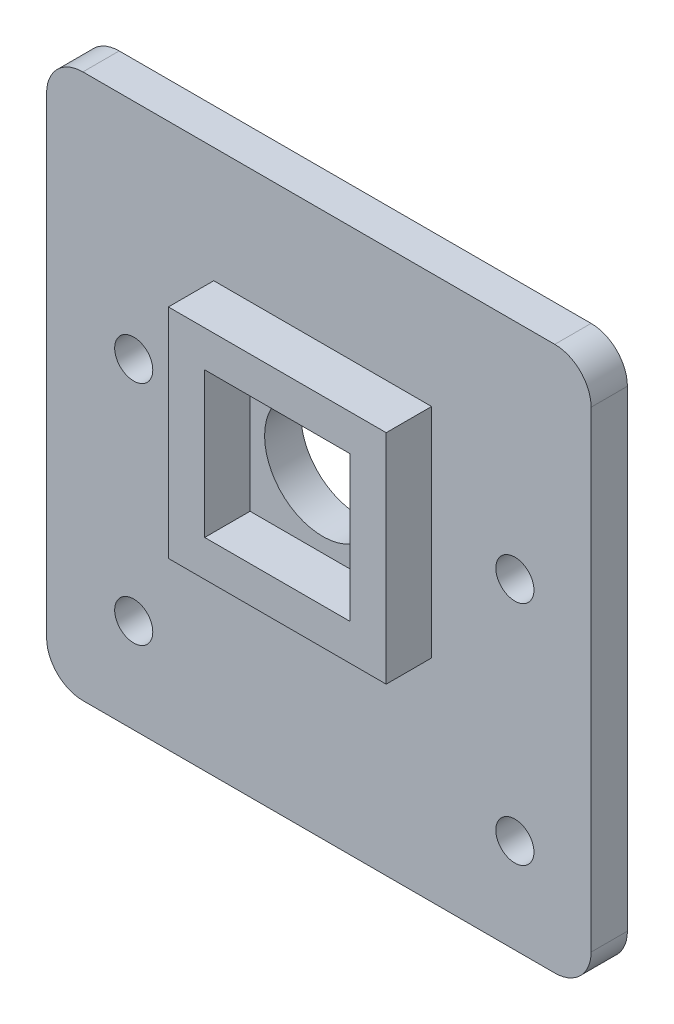
from build123d import *

# Parameters (mm, degrees)
SKETCH1_W           = 30
SKETCH1_H           = 30
BOSS_EXTRUDE1_DEPTH = 2
SKETCH2_R           = 1.05
CUT_EXTRUDE1_DEPTH  = 1.5
SKETCH7_W           = 12
SKETCH7_H           = 12
SKETCH7_W_2         = 8
SKETCH7_H_2         = 8
BOSS_EXTRUDE4_DEPTH = 2.5
SKETCH8_W           = 8
SKETCH8_H           = 8
CUT_EXTRUDE4_DEPTH  = 12.525
SKETCH9_W           = 8
SKETCH9_H           = 8
SKETCH9_R           = 3.2
BOSS_EXTRUDE5_DEPTH = 2
FILLET1_R           = 2
SKETCH12_RX         = 1.08225407
SKETCH12_RY         = 0.934496933
CUT_EXTRUDE6_DEPTH  = 1


with BuildPart() as part:
    # Sketch1 → Boss-Extrude1 (new body)
    with BuildSketch(Plane.XY):
        with Locations((-15, 15)):
            Rectangle(SKETCH1_W, SKETCH1_H)
    extrude(amount=BOSS_EXTRUDE1_DEPTH)

    # Sketch2 → Cut-Extrude1 (cut)
    with BuildSketch(Plane.XY.offset(2)):
        with Locations((-25.2, 5.199)):
            Circle(SKETCH2_R)
        with Locations((-4.2, 5.199)):
            Circle(SKETCH2_R)
        with Locations((-25.2, 17.699)):
            Circle(SKETCH2_R)
        with Locations((-4.2, 17.699)):
            Circle(SKETCH2_R)
    extrude(amount=-CUT_EXTRUDE1_DEPTH, mode=Mode.SUBTRACT)

    # Sketch7 → Boss-Extrude4 (add)
    with BuildSketch(Plane.XY.offset(2)):
        with Locations((-14.79, 17.64)):
            Rectangle(SKETCH7_W, SKETCH7_H)
        with Locations((-14.79, 17.64)):
            Rectangle(SKETCH7_W_2, SKETCH7_H_2, mode=Mode.SUBTRACT)
    extrude(amount=BOSS_EXTRUDE4_DEPTH)

    # Sketch8 → Cut-Extrude4 (cut)
    with BuildSketch(Plane.XY.offset(2)):
        with Locations((-14.79, 17.64)):
            Rectangle(SKETCH8_W, SKETCH8_H)
    extrude(amount=-CUT_EXTRUDE4_DEPTH, mode=Mode.SUBTRACT)

    # Sketch9 → Boss-Extrude5 (add)
    with BuildSketch(Plane(origin=(0, 0, 0), x_dir=(-1, 0, 0), z_dir=(0, 0, -1))):
        with Locations((14.79, 17.64)):
            Rectangle(SKETCH9_W, SKETCH9_H)
        with Locations((14.79, 17.64)):
            Circle(SKETCH9_R, mode=Mode.SUBTRACT)
    extrude(amount=-BOSS_EXTRUDE5_DEPTH)

    # Fillet1
    fillet1_edges = [part.edges().sort_by_distance(p)[0] for p in [
        (0, 0, 1),
        (-30, 0, 1),
        (-30, 30, 1),
        (0, 30, 1),
    ]]
    fillet(fillet1_edges, radius=FILLET1_R)

    # Sketch12 → Cut-Extrude6 (cut)
    with BuildSketch(Plane(origin=(0, 0, 0), x_dir=(-1, 0, 0), z_dir=(0, 0, -1))):
        with BuildLine():
            add(Edge.make_bspline(
                [(4.459403602, 19.771375259), (4.912407636, 19.269824461), (5.586398639, 19.277050424)],
                knots=[0, 0, 0, 1, 1, 1], degree=2))
            add(Edge.make_bspline(
                [(6.713393676, 19.771375259), (6.260389642, 19.269824461), (5.586398639, 19.277050424)],
                knots=[0, 0, 0, 1, 1, 1], degree=2))
            add(Edge.make_bspline(
                [(6.713393676, 19.771375259), (7.196052905, 19.952092522), (7.599188985, 20.273138892)],
                knots=[0, 0, 0, 1, 1, 1], degree=2))
            add(Edge.make_bspline(
                [(7.599188985, 20.273138892), (8.397558594, 20.602400878), (8.52603066, 21.461318387)],
                knots=[0, 0, 0, 1, 1, 1], degree=2))
            add(Edge.make_bspline(
                [(8.52603066, 21.461318387), (8.675799132, 21.754733655), (8.731344628, 22.079239005)],
                knots=[0, 0, 0, 1, 1, 1], degree=2))
            add(Edge.make_bspline(
                [(8.731344628, 22.079239005), (8.95937766, 22.334907166), (9.271923181, 23.113838557), (8.891670497, 23.844453066), (8.500758535, 24.129779947)],
                knots=[0, 0, 0, 0, 0.443043689, 1, 1, 1, 1], degree=3))
            add(Edge.make_bspline(
                [(8.500758535, 24.129779947), (8.478718718, 24.18503617), (8.457636185, 24.214759628), (8.428622759, 24.253712768)],
                knots=[0, 0, 0, 0, 1, 1, 1, 1], degree=3))
            add(Edge.make_bspline(
                [(8.428622759, 24.253712768), (8.428621924, 25.22422519), (7.626737517, 25.638554342)],
                knots=[0, 0, 0, 1, 1, 1], degree=2))
            add(Edge.make_bspline(
                [(7.626737517, 25.638554342), (7.860931009, 25.653004869), (7.93621595, 25.867644567)],
                knots=[0, 0, 0, 1, 1, 1], degree=2))
            add(Edge.make_bspline(
                [(7.93621595, 25.867644567), (8.074561594, 25.923571952), (8.214105248, 25.976133461), (8.2192724, 26.156628761)],
                knots=[0, 0, 0, 0, 1, 1, 1, 1], degree=3))
            add(Edge.make_bspline(
                [(8.2192724, 26.156628761), (8.424348668, 26.273546154), (8.445789796, 26.289542187), (8.460640776, 26.494419709)],
                knots=[0, 0, 0, 0, 1, 1, 1, 1], degree=3))
            add(Edge.make_bspline(
                [(8.460640776, 26.494419709), (8.666468831, 26.614269665), (8.600808664, 26.810969099)],
                knots=[0, 0, 0, 1, 1, 1], degree=2))
            add(Edge.make_bspline(
                [(8.600808664, 26.810969099), (8.686005059, 26.931306999), (8.78711559, 26.988922663), (8.695448657, 27.149855286)],
                knots=[0, 0, 0, 0, 1, 1, 1, 1], degree=3))
            add(Edge.make_bspline(
                [(8.695448657, 27.149855286), (8.874684574, 27.334661986), (8.70365618, 27.508525165)],
                knots=[0, 0, 0, 1, 1, 1], degree=2))
            add(Edge.make_bspline(
                [(8.70365618, 27.508525165), (8.817322065, 27.616661491), (8.74901534, 27.856821541), (8.591961084, 27.873600404)],
                knots=[0, 0, 0, 0, 1, 1, 1, 1], degree=3))
            add(Edge.make_bspline(
                [(8.591961084, 27.873600404), (8.510777555, 27.890602349), (8.428622759, 27.879782716)],
                knots=[0, 0, 0, 1, 1, 1], degree=2))
            add(Edge.make_bspline(
                [(8.428622759, 27.879782716), (8.346506515, 28.02047312), (8.179378561, 28.008018455)],
                knots=[0, 0, 0, 1, 1, 1], degree=2))
            add(Edge.make_bspline(
                [(8.179378561, 28.008018455), (8.098001415, 28.027466053), (8.015680886, 28.012512611)],
                knots=[0, 0, 0, 1, 1, 1], degree=2))
            add(Edge.make_bspline(
                [(8.015680886, 28.012512611), (7.961203369, 28.115859289), (7.82679737, 28.102795345), (7.732961122, 28.089490893)],
                knots=[0, 0, 0, 0, 1, 1, 1, 1], degree=3))
            add(Edge.make_bspline(
                [(7.732961122, 28.089490893), (7.626988483, 28.1763667), (7.582209475, 28.209626094), (7.355100325, 28.135078485)],
                knots=[0, 0, 0, 0, 1, 1, 1, 1], degree=3))
            add(Edge.make_bspline(
                [(7.355100325, 28.135078485), (7.161176886, 28.259963832), (6.966767125, 28.119172751)],
                knots=[0, 0, 0, 1, 1, 1], degree=2))
            add(Edge.make_bspline(
                [(6.966767125, 28.119172751), (6.784023173, 28.191921236), (6.625379677, 28.047927)],
                knots=[0, 0, 0, 1, 1, 1], degree=2))
            add(Edge.make_bspline(
                [(6.625379677, 28.047927), (6.470921635, 28.13787836), (6.335334768, 28.001630777), (6.253891197, 27.901475323)],
                knots=[0, 0, 0, 0, 1, 1, 1, 1], degree=3))
            add(Edge.make_bspline(
                [(6.253891197, 27.901475323), (6.184624009, 27.911295697), (6.07299926, 27.881514493), (5.938040799, 27.758029169), (5.716439457, 27.541148249), (5.586398639, 27.097153118)],
                knots=[0, 0, 0, 0, 0.092600111, 0.192600111, 1, 1, 1, 1], degree=3))
            add(Edge.make_bspline(
                [(4.918906081, 27.901475323), (4.988173268, 27.911295697), (5.099798017, 27.881514493), (5.234756478, 27.758029169), (5.45635782, 27.541148249), (5.586398639, 27.097153118)],
                knots=[0, 0, 0, 0, 0.092600111, 0.192600111, 1, 1, 1, 1], degree=3))
            add(Edge.make_bspline(
                [(4.5474176, 28.047927), (4.701875642, 28.13787836), (4.837462509, 28.001630777), (4.918906081, 27.901475323)],
                knots=[0, 0, 0, 0, 1, 1, 1, 1], degree=3))
            add(Edge.make_bspline(
                [(4.206030152, 28.119172751), (4.388774104, 28.191921236), (4.5474176, 28.047927)],
                knots=[0, 0, 0, 1, 1, 1], degree=2))
            add(Edge.make_bspline(
                [(3.817696952, 28.135078485), (4.011620391, 28.259963832), (4.206030152, 28.119172751)],
                knots=[0, 0, 0, 1, 1, 1], degree=2))
            add(Edge.make_bspline(
                [(3.439836155, 28.089490893), (3.545808795, 28.1763667), (3.590587802, 28.209626094), (3.817696952, 28.135078485)],
                knots=[0, 0, 0, 0, 1, 1, 1, 1], degree=3))
            add(Edge.make_bspline(
                [(3.157116391, 28.012512611), (3.211593908, 28.115859289), (3.345999907, 28.102795345), (3.439836155, 28.089490893)],
                knots=[0, 0, 0, 0, 1, 1, 1, 1], degree=3))
            add(Edge.make_bspline(
                [(2.993418716, 28.008018455), (3.074795862, 28.027466053), (3.157116391, 28.012512611)],
                knots=[0, 0, 0, 1, 1, 1], degree=2))
            add(Edge.make_bspline(
                [(2.744174518, 27.879782716), (2.826290763, 28.02047312), (2.993418716, 28.008018455)],
                knots=[0, 0, 0, 1, 1, 1], degree=2))
            add(Edge.make_bspline(
                [(2.580836193, 27.873600404), (2.662019722, 27.890602349), (2.744174518, 27.879782716)],
                knots=[0, 0, 0, 1, 1, 1], degree=2))
            add(Edge.make_bspline(
                [(2.469141098, 27.508525165), (2.355475212, 27.616661491), (2.423781937, 27.856821541), (2.580836193, 27.873600404)],
                knots=[0, 0, 0, 0, 1, 1, 1, 1], degree=3))
            add(Edge.make_bspline(
                [(2.47734862, 27.149855286), (2.298112703, 27.334661986), (2.469141098, 27.508525165)],
                knots=[0, 0, 0, 1, 1, 1], degree=2))
            add(Edge.make_bspline(
                [(2.571988613, 26.810969099), (2.486792218, 26.931306999), (2.385681687, 26.988922663), (2.47734862, 27.149855286)],
                knots=[0, 0, 0, 0, 1, 1, 1, 1], degree=3))
            add(Edge.make_bspline(
                [(2.712156501, 26.494419709), (2.506328446, 26.614269665), (2.571988613, 26.810969099)],
                knots=[0, 0, 0, 1, 1, 1], degree=2))
            add(Edge.make_bspline(
                [(2.953524877, 26.156628761), (2.748448609, 26.273546154), (2.727007481, 26.289542187), (2.712156501, 26.494419709)],
                knots=[0, 0, 0, 0, 1, 1, 1, 1], degree=3))
            add(Edge.make_bspline(
                [(3.236581327, 25.867644567), (3.098235683, 25.923571952), (2.95869203, 25.976133461), (2.953524877, 26.156628761)],
                knots=[0, 0, 0, 0, 1, 1, 1, 1], degree=3))
            add(Edge.make_bspline(
                [(3.54605976, 25.638554342), (3.311866268, 25.653004869), (3.236581327, 25.867644567)],
                knots=[0, 0, 0, 1, 1, 1], degree=2))
            add(Edge.make_bspline(
                [(2.744174518, 24.253712768), (2.744175353, 25.22422519), (3.54605976, 25.638554342)],
                knots=[0, 0, 0, 1, 1, 1], degree=2))
            add(Edge.make_bspline(
                [(2.672038742, 24.129779947), (2.694078559, 24.18503617), (2.715161092, 24.214759628), (2.744174518, 24.253712768)],
                knots=[0, 0, 0, 0, 1, 1, 1, 1], degree=3))
            add(Edge.make_bspline(
                [(2.44145265, 22.079239005), (2.213419618, 22.334907166), (1.900874096, 23.113838557), (2.28112678, 23.844453066), (2.672038742, 24.129779947)],
                knots=[0, 0, 0, 0, 0.443043689, 1, 1, 1, 1], degree=3))
            add(Edge.make_bspline(
                [(2.646766617, 21.461318387), (2.496998145, 21.754733655), (2.44145265, 22.079239005)],
                knots=[0, 0, 0, 1, 1, 1], degree=2))
            add(Edge.make_bspline(
                [(3.573608292, 20.273138892), (2.775238684, 20.602400878), (2.646766617, 21.461318387)],
                knots=[0, 0, 0, 1, 1, 1], degree=2))
            add(Edge.make_bspline(
                [(4.459403602, 19.771375259), (3.976744372, 19.952092522), (3.573608292, 20.273138892)],
                knots=[0, 0, 0, 1, 1, 1], degree=2))
        make_face()
        with Locations(Location((4.405907044, 23.508437964), (0, 0, 58.172946219))):
            Ellipse(SKETCH12_RX, SKETCH12_RY, mode=Mode.SUBTRACT)
        with Locations(Location((6.766890234, 23.508437964), (0, 0, 121.827053781))):
            Ellipse(SKETCH12_RX, SKETCH12_RY, mode=Mode.SUBTRACT)
        with BuildLine():
            Line((6.08649801, 26.438677052), (6.111751446, 26.436685192))
            add(Edge.make_bspline(
                [(6.111751446, 26.436685192), (6.885511107, 27.050721512), (7.824772953, 27.351752714)],
                knots=[0, 0, 0, 1, 1, 1], degree=2))
            add(Edge.make_bspline(
                [(7.824772953, 27.351752714), (7.454373779, 27.158058721), (6.904278751, 26.866591311), (6.42745025, 26.469902009), (6.235121044, 26.265811815)],
                knots=[0, 0, 0, 0, 0.517858007, 1, 1, 1, 1], degree=3))
            add(Edge.make_bspline(
                [(6.235121044, 26.265811815), (6.270374396, 26.140801177), (6.454124689, 25.775029957), (7.066579783, 25.690578213), (7.364524085, 25.721805094)],
                knots=[0, 0, 0, 0, 0.232284821, 1, 1, 1, 1], degree=3))
            add(Edge.make_bspline(
                [(7.364524085, 25.721805094), (7.289095896, 25.749377061), (7.2441534, 25.815470697)],
                knots=[0, 0, 0, 1, 1, 1], degree=2))
            add(Edge.make_bspline(
                [(7.2441534, 25.815470697), (7.479971995, 25.8262006), (7.70171926, 25.905261676)],
                knots=[0, 0, 0, 1, 1, 1], degree=2))
            add(Edge.make_bspline(
                [(7.70171926, 25.905261676), (7.620100101, 25.917656948), (7.574814139, 25.986053914)],
                knots=[0, 0, 0, 1, 1, 1], degree=2))
            add(Edge.make_bspline(
                [(7.574814139, 25.986053914), (7.799399897, 26.021224291), (7.986985455, 26.147741737)],
                knots=[0, 0, 0, 1, 1, 1], degree=2))
            add(Edge.make_bspline(
                [(7.986985455, 26.147741737), (7.895002718, 26.143175182), (7.824772953, 26.199753276)],
                knots=[0, 0, 0, 1, 1, 1], degree=2))
            add(Edge.make_bspline(
                [(7.824772953, 26.199753276), (8.049085207, 26.277525955), (8.224699767, 26.435655209)],
                knots=[0, 0, 0, 1, 1, 1], degree=2))
            add(Edge.make_bspline(
                [(8.224699767, 26.435655209), (8.136050851, 26.420029814), (8.060263374, 26.464368629)],
                knots=[0, 0, 0, 1, 1, 1], degree=2))
            add(Edge.make_bspline(
                [(8.060263374, 26.464368629), (8.23349761, 26.574811482), (8.376674573, 26.721758001)],
                knots=[0, 0, 0, 1, 1, 1], degree=2))
            add(Edge.make_bspline(
                [(8.376674573, 26.721758001), (8.286052566, 26.709117633), (8.206143834, 26.748898346)],
                knots=[0, 0, 0, 1, 1, 1], degree=2))
            add(Edge.make_bspline(
                [(8.206143834, 26.748898346), (8.377014116, 26.864310727), (8.491708975, 27.034206058)],
                knots=[0, 0, 0, 1, 1, 1], degree=2))
            add(Edge.make_bspline(
                [(8.491708975, 27.034206058), (8.385784369, 26.998241293), (8.287994307, 27.045482096)],
                knots=[0, 0, 0, 1, 1, 1], degree=2))
            add(Edge.make_bspline(
                [(8.287994307, 27.045482096), (8.442635079, 27.165959108), (8.546308384, 27.330655805)],
                knots=[0, 0, 0, 1, 1, 1], degree=2))
            add(Edge.make_bspline(
                [(8.546308384, 27.330655805), (8.456800152, 27.313699686), (8.366950746, 27.324132413)],
                knots=[0, 0, 0, 1, 1, 1], degree=2))
            add(Edge.make_bspline(
                [(8.366950746, 27.324132413), (8.408920944, 27.510064067), (8.540625658, 27.648445817)],
                knots=[0, 0, 0, 1, 1, 1], degree=2))
            add(Edge.make_bspline(
                [(8.540625658, 27.648445817), (8.331115101, 27.638655118), (8.122219886, 27.657787318)],
                knots=[0, 0, 0, 1, 1, 1], degree=2))
            add(Edge.make_bspline(
                [(8.122219886, 27.657787318), (8.166226584, 27.72191231), (8.228695231, 27.768286277)],
                knots=[0, 0, 0, 1, 1, 1], degree=2))
            add(Edge.make_bspline(
                [(8.228695231, 27.768286277), (8.002049808, 27.819175755), (7.779484934, 27.725127608)],
                knots=[0, 0, 0, 1, 1, 1], degree=2))
            add(Edge.make_bspline(
                [(7.779484934, 27.725127608), (7.698207386, 27.760325889), (7.815128112, 27.858727649), (7.847720075, 27.86351944)],
                knots=[0, 0, 0, 0, 1, 1, 1, 1], degree=3))
            add(Edge.make_bspline(
                [(7.847720075, 27.86351944), (7.646450968, 27.87197809), (7.463642507, 27.777476203)],
                knots=[0, 0, 0, 1, 1, 1], degree=2))
            add(Edge.make_bspline(
                [(7.463642507, 27.777476203), (7.420242067, 27.82092425), (7.479417005, 27.869007732), (7.557483786, 27.940730551)],
                knots=[0, 0, 0, 0, 1, 1, 1, 1], degree=3))
            add(Edge.make_bspline(
                [(7.557483786, 27.940730551), (7.337700995, 27.918283814), (7.159609967, 27.791409039)],
                knots=[0, 0, 0, 1, 1, 1], degree=2))
            add(Edge.make_bspline(
                [(7.159609967, 27.791409039), (7.089781524, 27.827253318), (7.162497176, 27.926863021), (7.196015201, 27.952675018)],
                knots=[0, 0, 0, 0, 1, 1, 1, 1], degree=3))
            add(Edge.make_bspline(
                [(7.196015201, 27.952675018), (7.002250721, 27.895616459), (6.859945024, 27.754122582)],
                knots=[0, 0, 0, 1, 1, 1], degree=2))
            add(Edge.make_bspline(
                [(6.859945024, 27.754122582), (6.78458604, 27.82488446), (6.850124774, 27.905105945)],
                knots=[0, 0, 0, 1, 1, 1], degree=2))
            add(Edge.make_bspline(
                [(6.850124774, 27.905105945), (6.69376598, 27.827707321), (6.592525069, 27.687902192)],
                knots=[0, 0, 0, 1, 1, 1], degree=2))
            add(Edge.make_bspline(
                [(6.592525069, 27.687902192), (6.535036206, 27.70853545), (6.514292349, 27.733980608), (6.537031069, 27.844373499)],
                knots=[0, 0, 0, 0, 1, 1, 1, 1], degree=3))
            add(Edge.make_bspline(
                [(6.537031069, 27.844373499), (6.364380434, 27.718672212), (6.249148418, 27.538848703)],
                knots=[0, 0, 0, 1, 1, 1], degree=2))
            add(Edge.make_bspline(
                [(6.249148418, 27.538848703), (6.204292053, 27.595387917), (6.201607217, 27.668184547)],
                knots=[0, 0, 0, 1, 1, 1], degree=2))
            add(Edge.make_bspline(
                [(6.201607217, 27.668184547), (6.066821617, 27.567774233), (5.894337442, 27.298863011), (5.742246132, 26.821171911), (5.85300032, 26.54971625), (6.08649801, 26.438677052)],
                knots=[0, 0, 0, 0, 0.370606673, 0.596988374, 1, 1, 1, 1], degree=3))
        make_face(mode=Mode.SUBTRACT)
        with BuildLine():
            ThreePointArc((4.612820244, 22.00098137), (4.567981089, 21.763409199), (4.580272209, 21.521955239))
            add(Edge.make_bspline(
                [(4.580272209, 21.521955239), (4.776572867, 20.963402314), (5.225788367, 20.789034476), (5.586398639, 20.791439779)],
                knots=[0, 0, 0, 0, 0.451501299, 0.451501299, 0.451501299, 0.451501299], degree=3))
            add(Edge.make_bspline(
                [(6.592525069, 21.521955239), (6.39622441, 20.963402314), (5.94700891, 20.789034476), (5.586398639, 20.791439779)],
                knots=[0, 0, 0, 0, 0.451501299, 0.451501299, 0.451501299, 0.451501299], degree=3))
            ThreePointArc((6.592525069, 21.521955239), (6.604816189, 21.763409199), (6.559977033, 22.00098137))
            add(Edge.make_bspline(
                [(6.559977033, 22.00098137), (6.357454249, 22.467885386), (5.986560514, 22.67199591), (5.586398639, 22.666403467)],
                knots=[0, 0, 0, 0, 0.494480302, 0.494480302, 0.494480302, 0.494480302], degree=3))
            add(Edge.make_bspline(
                [(4.612820244, 22.00098137), (4.815343029, 22.467885386), (5.186236764, 22.67199591), (5.586398639, 22.666403467)],
                knots=[0, 0, 0, 0, 0.494480302, 0.494480302, 0.494480302, 0.494480302], degree=3))
        make_face(mode=Mode.SUBTRACT)
        with BuildLine():
            add(Edge.make_bspline(
                [(3.764742911, 20.500365273), (5.404831735, 19.783274916), (4.131472178, 21.600691919), (2.858112621, 23.418108923), (2.907931563, 21.723259077)],
                knots=[2.366966, 2.366966, 2.366966, 4.663333265, 4.663333265, 6.959700531, 6.959700531, 6.959700531], degree=2, weights=[1, 0.410144681, 1, 0.410144681, 1]))
            add(Edge.make_bspline(
                [(2.907931563, 21.723259077), (2.920038841, 20.812145325), (3.764742911, 20.500365273)],
                knots=[0, 0, 0, 1, 1, 1], degree=2))
        make_face(mode=Mode.SUBTRACT)
        with BuildLine():
            add(Edge.make_bspline(
                [(8.264865714, 21.723259077), (8.314684657, 23.418108923), (7.0413251, 21.600691919), (5.767965543, 19.783274916), (7.408054366, 20.500365273)],
                knots=[5.606670083, 5.606670083, 5.606670083, 7.903037349, 7.903037349, 10.199404615, 10.199404615, 10.199404615], degree=2, weights=[1, 0.410144681, 1, 0.410144681, 1]))
            add(Edge.make_bspline(
                [(8.264865714, 21.723259077), (8.252758437, 20.812145325), (7.408054366, 20.500365273)],
                knots=[0, 0, 0, 1, 1, 1], degree=2))
        make_face(mode=Mode.SUBTRACT)
        with BuildLine():
            add(Edge.make_bspline(
                [(4.466123523, 25.441001911), (4.086927345, 25.540969838), (3.700713194, 25.458186294), (3.199637125, 25.064802498), (3.025415423, 24.718685589), (3.027167829, 24.259268783)],
                knots=[0, 0, 0, 0, 0.450332453, 0.550332453, 1, 1, 1, 1], degree=3))
            add(Edge.make_bspline(
                [(3.027167829, 24.259268783), (3.106748087, 24.237012666), (3.178442721, 24.273641573)],
                knots=[0, 0, 0, 1, 1, 1], degree=2))
            add(Edge.make_bspline(
                [(4.419218373, 25.299768821), (3.902694398, 24.66228955), (3.178442721, 24.273641573)],
                knots=[0, 0, 0, 1, 1, 1], degree=2))
            add(Edge.make_bspline(
                [(4.466123523, 25.441001911), (4.480312154, 25.356940397), (4.419218373, 25.299768821)],
                knots=[0, 0, 0, 1, 1, 1], degree=2))
        make_face(mode=Mode.SUBTRACT)
        with BuildLine():
            add(Edge.make_bspline(
                [(2.920149283, 23.95932049), (2.566641088, 23.757628895), (2.212726891, 23.085074878), (2.472798313, 22.44950358), (2.703652148, 22.225813707)],
                knots=[0, 0, 0, 0, 0.560262141, 1, 1, 1, 1], degree=3))
            add(Edge.make_bspline(
                [(2.703652148, 22.225813707), (2.831680868, 22.205991931), (2.918931189, 22.368104891), (2.953524877, 22.458251966)],
                knots=[0, 0, 0, 0, 1, 1, 1, 1], degree=3))
            add(Edge.make_bspline(
                [(3.129952842, 23.606412415), (3.159527259, 23.014069316), (2.953524877, 22.458251966)],
                knots=[0, 0, 0, 1, 1, 1], degree=2))
            add(Edge.make_bspline(
                [(2.920149283, 23.95932049), (2.9672441, 23.980027055), (3.095998434, 23.880874992), (3.118827643, 23.716003892), (3.129952842, 23.606412415)],
                knots=[0, 0, 0, 0, 0.260652377, 1, 1, 1, 1], degree=3))
        make_face(mode=Mode.SUBTRACT)
        with BuildLine():
            add(Edge.make_bspline(
                [(4.592762054, 20.132257683), (4.628084178, 20.266986671), (4.821483922, 20.361236592), (5.156980432, 20.477817385), (5.290149775, 20.471163199), (5.586398639, 20.490509382)],
                knots=[0, 0, 0, 0, 0.336340026, 0.436340026, 1, 1, 1, 1], degree=3))
            add(Edge.make_bspline(
                [(6.580035224, 20.132257683), (6.5447131, 20.266986671), (6.351313355, 20.361236592), (6.015816846, 20.477817385), (5.882647503, 20.471163199), (5.586398639, 20.490509382)],
                knots=[0, 0, 0, 0, 0.336340026, 0.436340026, 1, 1, 1, 1], degree=3))
            add(Edge.make_bspline(
                [(6.580035224, 20.132257683), (6.587849476, 20.086275127), (6.566483757, 20.045488858)],
                knots=[0, 0, 0, 1, 1, 1], degree=2))
            add(Edge.make_bspline(
                [(6.566483757, 20.045488858), (6.468634283, 19.895351444), (6.288690006, 19.744880025), (5.984390237, 19.604380093), (5.797845315, 19.549618163), (5.586398639, 19.555887753)],
                knots=[0, 0, 0, 0, 0.397504027, 0.497504027, 1, 1, 1, 1], degree=3))
            add(Edge.make_bspline(
                [(4.606313521, 20.045488858), (4.704162994, 19.895351444), (4.884107271, 19.744880025), (5.188407041, 19.604380093), (5.374951962, 19.549618163), (5.586398639, 19.555887753)],
                knots=[0, 0, 0, 0, 0.397504027, 0.497504027, 1, 1, 1, 1], degree=3))
            add(Edge.make_bspline(
                [(4.592762054, 20.132257683), (4.584947801, 20.086275127), (4.606313521, 20.045488858)],
                knots=[0, 0, 0, 1, 1, 1], degree=2))
        make_face(mode=Mode.SUBTRACT)
        with BuildLine():
            add(Edge.make_bspline(
                [(5.586398639, 25.692086573), (5.276104282, 25.712556849), (4.803293798, 25.516618594), (4.659899355, 25.213870909)],
                knots=[0, 0, 0, 0, 1, 1, 1, 1], degree=3))
            add(Edge.make_bspline(
                [(4.659899355, 25.213870909), (4.633193994, 25.112676741), (4.67455899, 25.016009288)],
                knots=[0, 0, 0, 1, 1, 1], degree=2))
            add(Edge.make_bspline(
                [(4.67455899, 25.016009288), (4.720297226, 24.888156462), (5.027505864, 24.675460093), (5.368291476, 24.614462454), (5.586398639, 24.609837723)],
                knots=[0, 0, 0, 0, 0.380769232, 1, 1, 1, 1], degree=3))
            add(Edge.make_bspline(
                [(6.498238287, 25.016009288), (6.452500051, 24.888156462), (6.145291414, 24.675460093), (5.804505801, 24.614462454), (5.586398639, 24.609837723)],
                knots=[0, 0, 0, 0, 0.380769232, 1, 1, 1, 1], degree=3))
            add(Edge.make_bspline(
                [(6.512897923, 25.213870909), (6.539603283, 25.112676741), (6.498238287, 25.016009288)],
                knots=[0, 0, 0, 1, 1, 1], degree=2))
            add(Edge.make_bspline(
                [(5.586398639, 25.692086573), (5.896692996, 25.712556849), (6.369503479, 25.516618594), (6.512897923, 25.213870909)],
                knots=[0, 0, 0, 0, 1, 1, 1, 1], degree=3))
        make_face(mode=Mode.SUBTRACT)
        with BuildLine():
            add(Edge.make_bspline(
                [(8.042844435, 23.606412415), (8.013270018, 23.014069316), (8.2192724, 22.458251966)],
                knots=[0, 0, 0, 1, 1, 1], degree=2))
            add(Edge.make_bspline(
                [(8.469145129, 22.225813707), (8.34111641, 22.205991931), (8.253866088, 22.368104891), (8.2192724, 22.458251966)],
                knots=[0, 0, 0, 0, 1, 1, 1, 1], degree=3))
            add(Edge.make_bspline(
                [(8.252647994, 23.95932049), (8.606156189, 23.757628895), (8.960070386, 23.085074878), (8.699998964, 22.44950358), (8.469145129, 22.225813707)],
                knots=[0, 0, 0, 0, 0.560262141, 1, 1, 1, 1], degree=3))
            add(Edge.make_bspline(
                [(8.252647994, 23.95932049), (8.205553178, 23.980027055), (8.076798843, 23.880874992), (8.053969635, 23.716003892), (8.042844435, 23.606412415)],
                knots=[0, 0, 0, 0, 0.260652377, 1, 1, 1, 1], degree=3))
        make_face(mode=Mode.SUBTRACT)
        with BuildLine():
            add(Edge.make_bspline(
                [(6.753578904, 25.299768821), (7.270102879, 24.66228955), (7.994354556, 24.273641573)],
                knots=[0, 0, 0, 1, 1, 1], degree=2))
            add(Edge.make_bspline(
                [(8.145629448, 24.259268783), (8.066049191, 24.237012666), (7.994354556, 24.273641573)],
                knots=[0, 0, 0, 1, 1, 1], degree=2))
            add(Edge.make_bspline(
                [(6.706673755, 25.441001911), (7.085869932, 25.540969838), (7.472084083, 25.458186294), (7.973160152, 25.064802498), (8.147381855, 24.718685589), (8.145629448, 24.259268783)],
                knots=[0, 0, 0, 0, 0.450332453, 0.550332453, 1, 1, 1, 1], degree=3))
            add(Edge.make_bspline(
                [(6.706673755, 25.441001911), (6.692485123, 25.356940397), (6.753578904, 25.299768821)],
                knots=[0, 0, 0, 1, 1, 1], degree=2))
        make_face(mode=Mode.SUBTRACT)
        with BuildLine():
            add(Edge.make_bspline(
                [(3.808273192, 25.721805094), (3.883701381, 25.749377061), (3.928643877, 25.815470697)],
                knots=[0, 0, 0, 1, 1, 1], degree=2))
            add(Edge.make_bspline(
                [(3.928643877, 25.815470697), (3.692825282, 25.8262006), (3.471078017, 25.905261676)],
                knots=[0, 0, 0, 1, 1, 1], degree=2))
            add(Edge.make_bspline(
                [(3.471078017, 25.905261676), (3.552697176, 25.917656948), (3.597983138, 25.986053914)],
                knots=[0, 0, 0, 1, 1, 1], degree=2))
            add(Edge.make_bspline(
                [(3.597983138, 25.986053914), (3.373397381, 26.021224291), (3.185811822, 26.147741737)],
                knots=[0, 0, 0, 1, 1, 1], degree=2))
            add(Edge.make_bspline(
                [(3.185811822, 26.147741737), (3.27779456, 26.143175182), (3.348024324, 26.199753276)],
                knots=[0, 0, 0, 1, 1, 1], degree=2))
            add(Edge.make_bspline(
                [(3.348024324, 26.199753276), (3.12371207, 26.277525955), (2.94809751, 26.435655209)],
                knots=[0, 0, 0, 1, 1, 1], degree=2))
            add(Edge.make_bspline(
                [(2.94809751, 26.435655209), (3.036746426, 26.420029814), (3.112533904, 26.464368629)],
                knots=[0, 0, 0, 1, 1, 1], degree=2))
            add(Edge.make_bspline(
                [(3.112533904, 26.464368629), (2.939299667, 26.574811482), (2.796122705, 26.721758001)],
                knots=[0, 0, 0, 1, 1, 1], degree=2))
            add(Edge.make_bspline(
                [(2.796122705, 26.721758001), (2.886744711, 26.709117633), (2.966653443, 26.748898346)],
                knots=[0, 0, 0, 1, 1, 1], degree=2))
            add(Edge.make_bspline(
                [(2.966653443, 26.748898346), (2.795783161, 26.864310727), (2.681088302, 27.034206058)],
                knots=[0, 0, 0, 1, 1, 1], degree=2))
            add(Edge.make_bspline(
                [(2.681088302, 27.034206058), (2.787012908, 26.998241293), (2.884802971, 27.045482096)],
                knots=[0, 0, 0, 1, 1, 1], degree=2))
            add(Edge.make_bspline(
                [(2.884802971, 27.045482096), (2.730162198, 27.165959108), (2.626488893, 27.330655805)],
                knots=[0, 0, 0, 1, 1, 1], degree=2))
            add(Edge.make_bspline(
                [(2.626488893, 27.330655805), (2.715997126, 27.313699686), (2.805846531, 27.324132413)],
                knots=[0, 0, 0, 1, 1, 1], degree=2))
            add(Edge.make_bspline(
                [(2.805846531, 27.324132413), (2.763876333, 27.510064067), (2.632171619, 27.648445817)],
                knots=[0, 0, 0, 1, 1, 1], degree=2))
            add(Edge.make_bspline(
                [(2.632171619, 27.648445817), (2.841682176, 27.638655118), (3.050577391, 27.657787318)],
                knots=[0, 0, 0, 1, 1, 1], degree=2))
            add(Edge.make_bspline(
                [(3.050577391, 27.657787318), (3.006570693, 27.72191231), (2.944102046, 27.768286277)],
                knots=[0, 0, 0, 1, 1, 1], degree=2))
            add(Edge.make_bspline(
                [(2.944102046, 27.768286277), (3.17074747, 27.819175755), (3.393312344, 27.725127608)],
                knots=[0, 0, 0, 1, 1, 1], degree=2))
            add(Edge.make_bspline(
                [(3.393312344, 27.725127608), (3.474589891, 27.760325889), (3.357669166, 27.858727649), (3.325077202, 27.86351944)],
                knots=[0, 0, 0, 0, 1, 1, 1, 1], degree=3))
            add(Edge.make_bspline(
                [(3.325077202, 27.86351944), (3.526346309, 27.87197809), (3.709154771, 27.777476203)],
                knots=[0, 0, 0, 1, 1, 1], degree=2))
            add(Edge.make_bspline(
                [(3.709154771, 27.777476203), (3.75255521, 27.82092425), (3.693380272, 27.869007732), (3.615313492, 27.940730551)],
                knots=[0, 0, 0, 0, 1, 1, 1, 1], degree=3))
            add(Edge.make_bspline(
                [(3.615313492, 27.940730551), (3.835096282, 27.918283814), (4.01318731, 27.791409039)],
                knots=[0, 0, 0, 1, 1, 1], degree=2))
            add(Edge.make_bspline(
                [(4.01318731, 27.791409039), (4.083015753, 27.827253318), (4.010300102, 27.926863021), (3.976782076, 27.952675018)],
                knots=[0, 0, 0, 0, 1, 1, 1, 1], degree=3))
            add(Edge.make_bspline(
                [(3.976782076, 27.952675018), (4.170546556, 27.895616459), (4.312852254, 27.754122582)],
                knots=[0, 0, 0, 1, 1, 1], degree=2))
            add(Edge.make_bspline(
                [(4.312852254, 27.754122582), (4.388211237, 27.82488446), (4.322672503, 27.905105945)],
                knots=[0, 0, 0, 1, 1, 1], degree=2))
            add(Edge.make_bspline(
                [(4.322672503, 27.905105945), (4.479031297, 27.827707321), (4.580272209, 27.687902192)],
                knots=[0, 0, 0, 1, 1, 1], degree=2))
            add(Edge.make_bspline(
                [(4.580272209, 27.687902192), (4.637761071, 27.70853545), (4.658504928, 27.733980608), (4.635766208, 27.844373499)],
                knots=[0, 0, 0, 0, 1, 1, 1, 1], degree=3))
            add(Edge.make_bspline(
                [(4.635766208, 27.844373499), (4.808416843, 27.718672212), (4.923648859, 27.538848703)],
                knots=[0, 0, 0, 1, 1, 1], degree=2))
            add(Edge.make_bspline(
                [(4.923648859, 27.538848703), (4.968505224, 27.595387917), (4.97119006, 27.668184547)],
                knots=[0, 0, 0, 1, 1, 1], degree=2))
            add(Edge.make_bspline(
                [(4.97119006, 27.668184547), (5.10597566, 27.567774233), (5.278459835, 27.298863011), (5.430551146, 26.821171911), (5.319796957, 26.54971625), (5.086299268, 26.438677052)],
                knots=[0, 0, 0, 0, 0.370606673, 0.596988374, 1, 1, 1, 1], degree=3))
            Line((5.086299268, 26.438677052), (5.061045832, 26.436685192))
            add(Edge.make_bspline(
                [(5.061045832, 26.436685192), (4.28728617, 27.050721512), (3.348024324, 27.351752714)],
                knots=[0, 0, 0, 1, 1, 1], degree=2))
            add(Edge.make_bspline(
                [(3.348024324, 27.351752714), (3.718423499, 27.158058721), (4.268518526, 26.866591311), (4.745347027, 26.469902009), (4.937676234, 26.265811815)],
                knots=[0, 0, 0, 0, 0.517858007, 1, 1, 1, 1], degree=3))
            add(Edge.make_bspline(
                [(4.937676234, 26.265811815), (4.902422882, 26.140801177), (4.718672588, 25.775029957), (4.106217494, 25.690578213), (3.808273192, 25.721805094)],
                knots=[0, 0, 0, 0, 0.232284821, 1, 1, 1, 1], degree=3))
        make_face(mode=Mode.SUBTRACT)
    extrude(amount=-CUT_EXTRUDE6_DEPTH, mode=Mode.SUBTRACT)


solid = part.part
